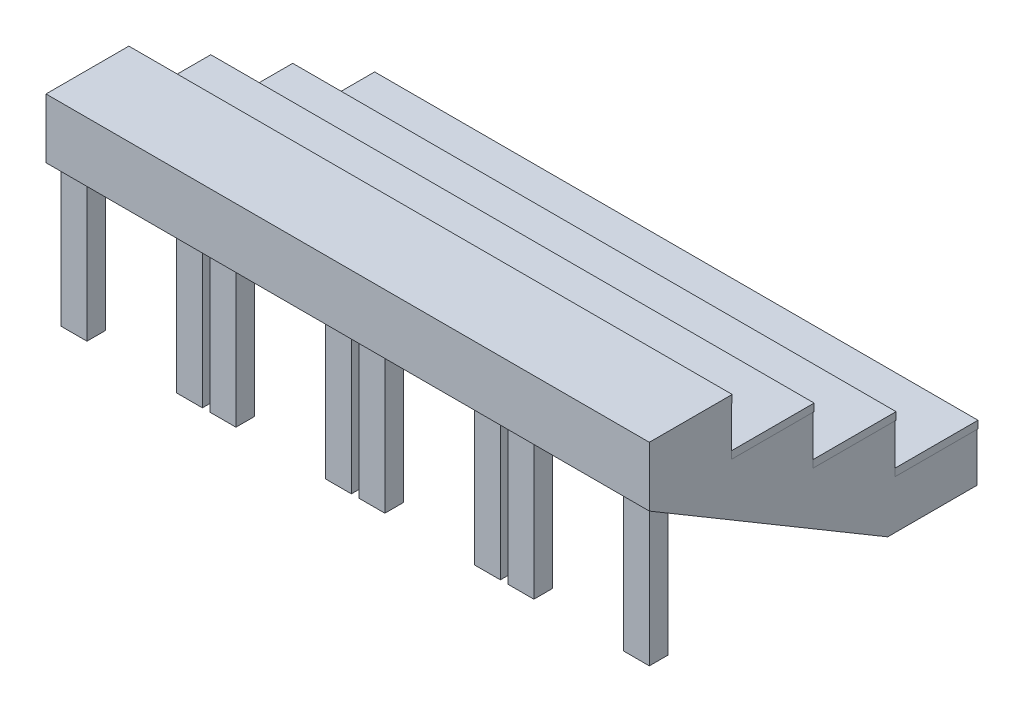
from build123d import *

# Parameters (mm, degrees)
BOSS_EXTRUDE1_DEPTH   = 25.4
LPATTERN1_COUNT       = 5
LPATTERN1_PITCH       = 508
SKETCH2_W             = 282.575
SKETCH2_H             = 25.4
BOSS_EXTRUDE2_DEPTH   = 2057.4
BOSS_EXTRUDE2_2_DEPTH = 2057.4
BOSS_EXTRUDE2_3_DEPTH = 2057.4
BOSS_EXTRUDE2_4_DEPTH = 2057.4
SKETCH3_W             = 25.4
SKETCH3_H             = 177.8
BOSS_EXTRUDE3_DEPTH   = 2006.6
SKETCH5_W             = 88.9
SKETCH5_H             = 63.5
BOSS_EXTRUDE4_DEPTH   = 660.4
BOSS_EXTRUDE4_2_DEPTH = 660.4
LPATTERN2_COUNT       = 4
LPATTERN2_PITCH       = 508


with BuildPart() as part:
    # Sketch1 → Boss-Extrude1 (new body)
    with BuildSketch(Plane(origin=(0, 0, 0), x_dir=(0, 0, -1), z_dir=(1, 0, 0))):
        Polygon((0, 0), (0, 165.1), (-279.4, 165.1), (-279.4, 330.2), (-558.8, 330.2), (-558.8, 495.3), (-838.2, 495.3), (-838.2, 660.4), (-1117.6, 660.4), (-1117.6, 482.6), (-304.8, 0), align=None)
    extrude(amount=BOSS_EXTRUDE1_DEPTH)


with BuildPart() as lpattern1_1:
    # LPattern1: pattern copy
    add(part.part.moved(Location(Vector(1, 0, 0) * (1 * LPATTERN1_PITCH))))


with BuildPart() as lpattern1_2:
    # LPattern1: pattern copy
    add(part.part.moved(Location(Vector(1, 0, 0) * (2 * LPATTERN1_PITCH))))


with BuildPart() as lpattern1_3:
    # LPattern1: pattern copy
    add(part.part.moved(Location(Vector(1, 0, 0) * (3 * LPATTERN1_PITCH))))


with BuildPart() as lpattern1_4:
    # LPattern1: pattern copy
    add(part.part.moved(Location(Vector(1, 0, 0) * (4 * LPATTERN1_PITCH))))


with BuildPart() as body_6:
    # Sketch2 → Boss-Extrude2 (new body)
    with BuildSketch(Plane(origin=(2057.4, 0, 0), x_dir=(0, 0, -1), z_dir=(1, 0, 0))):
        with Locations((-138.1125, 177.8)):
            Rectangle(SKETCH2_W, SKETCH2_H)
    extrude(amount=-BOSS_EXTRUDE2_DEPTH)


with BuildPart() as body_7:
    # Sketch2 → Boss-Extrude2 2 (new body)
    with BuildSketch(Plane(origin=(2057.4, 0, 0), x_dir=(0, 0, -1), z_dir=(1, 0, 0))):
        with Locations((-417.5125, 342.9)):
            Rectangle(SKETCH2_W, SKETCH2_H)
    extrude(amount=-BOSS_EXTRUDE2_2_DEPTH)


with BuildPart() as body_8:
    # Sketch2 → Boss-Extrude2 3 (new body)
    with BuildSketch(Plane(origin=(2057.4, 0, 0), x_dir=(0, 0, -1), z_dir=(1, 0, 0))):
        with Locations((-696.9125, 508)):
            Rectangle(SKETCH2_W, SKETCH2_H)
    extrude(amount=-BOSS_EXTRUDE2_3_DEPTH)


with BuildPart() as body_9:
    # Sketch2 → Boss-Extrude2 4 (new body)
    with BuildSketch(Plane(origin=(2057.4, 0, 0), x_dir=(0, 0, -1), z_dir=(1, 0, 0))):
        with Locations((-976.3125, 673.1)):
            Rectangle(SKETCH2_W, SKETCH2_H)
    extrude(amount=-BOSS_EXTRUDE2_4_DEPTH)


with BuildPart() as part_1:
    add(part.part)

    add(lpattern1_1.part)  # Boss-Extrude3 merges LPattern1_1

    add(lpattern1_2.part)  # Boss-Extrude3 merges LPattern1_2

    add(lpattern1_3.part)  # Boss-Extrude3 merges LPattern1_3

    add(lpattern1_4.part)  # Boss-Extrude3 merges LPattern1_4

    add(body_9.part)  # Boss-Extrude3 merges body 9
    # Sketch3 → Boss-Extrude3 (add)
    with BuildSketch(Plane(origin=(25.4, 0, 0), x_dir=(0, 0, -1), z_dir=(1, 0, 0))):
        with Locations((-1104.9, 571.5)):
            Rectangle(SKETCH3_W, SKETCH3_H)
    extrude(amount=BOSS_EXTRUDE3_DEPTH)


with BuildPart() as body_5:
    # Sketch5 → Boss-Extrude4 (new body)
    with BuildSketch(Plane.XZ.offset(-660.4)):
        with Locations((69.85, 1060.45)):
            Rectangle(SKETCH5_W, SKETCH5_H)
    extrude(amount=BOSS_EXTRUDE4_DEPTH)


with BuildPart() as body_6_2:
    # Sketch5 → Boss-Extrude4 2 (new body)
    with BuildSketch(Plane.XZ.offset(-660.4)):
        with Locations((463.55, 1060.45)):
            Rectangle(SKETCH5_W, SKETCH5_H)
    extrude(amount=BOSS_EXTRUDE4_2_DEPTH)


with BuildPart() as lpattern2_1:
    # LPattern2: pattern copy
    add(body_6_2.part.moved(Location(Vector(1, 0, 0) * (1 * LPATTERN2_PITCH))))


with BuildPart() as lpattern2_2:
    # LPattern2: pattern copy
    add(body_6_2.part.moved(Location(Vector(1, 0, 0) * (2 * LPATTERN2_PITCH))))


with BuildPart() as lpattern2_3:
    # LPattern2: pattern copy
    add(body_6_2.part.moved(Location(Vector(1, 0, 0) * (3 * LPATTERN2_PITCH))))


with BuildPart() as lpattern2_4:
    # LPattern2: pattern copy
    add(body_5.part.moved(Location(Vector(1, 0, 0) * (1 * LPATTERN2_PITCH))))


with BuildPart() as lpattern2_5:
    # LPattern2: pattern copy
    add(body_5.part.moved(Location(Vector(1, 0, 0) * (2 * LPATTERN2_PITCH))))


with BuildPart() as lpattern2_6:
    # LPattern2: pattern copy
    add(body_5.part.moved(Location(Vector(1, 0, 0) * (3 * LPATTERN2_PITCH))))


solid = Compound([body_6.part, body_7.part, body_8.part, part_1.part, body_5.part, body_6_2.part, lpattern2_1.part, lpattern2_2.part, lpattern2_3.part, lpattern2_4.part, lpattern2_5.part, lpattern2_6.part])
